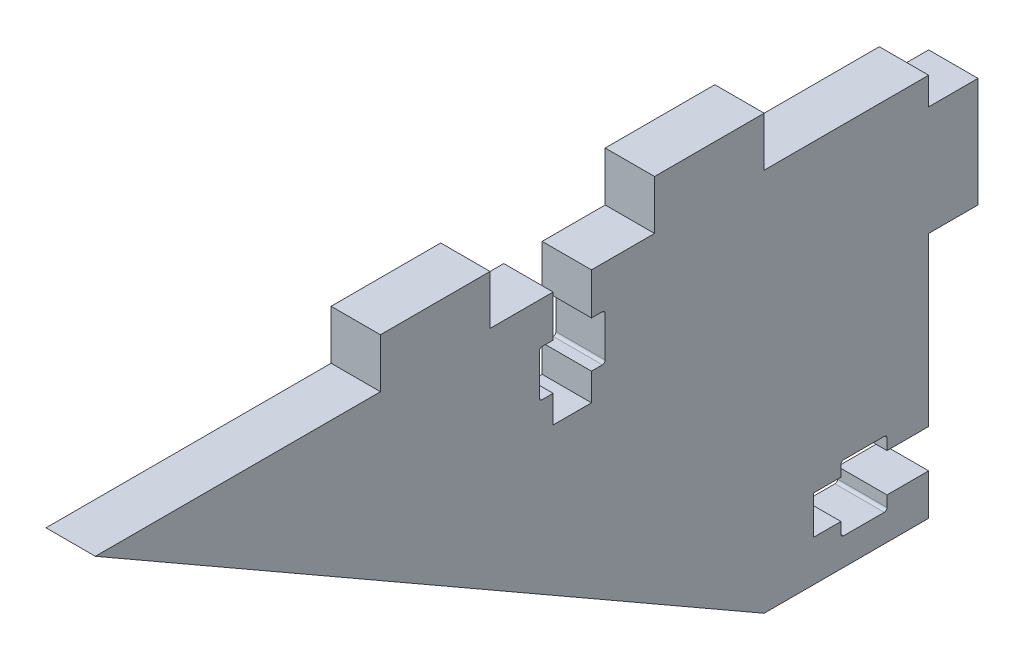
from build123d import *

# Parameters (mm, degrees)
BOSS_EXTRUDE1_DEPTH = 4.5
SKETCH2_W           = 9
SKETCH2_H           = 10
BOSS_EXTRUDE2_DEPTH = 4.5
BOSS_EXTRUDE3_DEPTH = 4.5
CUT_EXTRUDE1_DEPTH  = 84.792899461
SKETCH5_W           = 10
SKETCH5_H           = 9
BOSS_EXTRUDE4_DEPTH = 4.5
CUT_EXTRUDE2_DEPTH  = 84.792899461


with BuildPart() as part:
    # Sketch1 → Boss-Extrude1 (new body)
    with BuildSketch(Plane(origin=(0, 0, 0), x_dir=(0, 0, -1), z_dir=(1, 0, 0))):
        Polygon((0, 0), (0, -35), (-76, 0), align=None)
    extrude(amount=BOSS_EXTRUDE1_DEPTH)

    # Sketch2 → Boss-Extrude2 (add, through all)
    with BuildSketch(Plane(origin=(4.5, 0, 0), x_dir=(0, 0, -1), z_dir=(1, 0, 0))):
        with Locations((0, -7.5)):
            Rectangle(SKETCH2_W, SKETCH2_H)
    extrude(amount=-BOSS_EXTRUDE2_DEPTH)

    # Sketch3 → Boss-Extrude3 (add, through all)
    with BuildSketch(Plane(origin=(4.5, 0, 0), x_dir=(0, 0, -1), z_dir=(1, 0, 0))):
        Polygon((0, -35), (-15, -35), (-76, 0), (0, -25), align=None)
    extrude(amount=-BOSS_EXTRUDE3_DEPTH)

    # Sketch4 → Cut-Extrude1 (cut, through all)
    with BuildSketch(Plane(origin=(4.5, 0, 0), x_dir=(0, 0, -1), z_dir=(1, 0, 0))):
        with BuildLine():
            Line((0, -31.25), (0, -27.75))
            Line((0, -27.75), (-3.8, -27.75))
            Line((-3.8, -27.75), (-3.8, -26.75))
            ThreePointArc((-3.8, -26.75), (-3.873223305, -26.573223305), (-4.05, -26.5))
            Line((-4.05, -26.5), (-7.75, -26.5))
            ThreePointArc((-7.75, -26.5), (-7.926776695, -26.573223305), (-8, -26.75))
            Line((-8, -26.75), (-8, -27.75))
            Line((-8, -27.75), (-10.5, -27.75))
            Line((-10.5, -27.75), (-10.5, -31.25))
            Line((-10.5, -31.25), (-8, -31.25))
            Line((-8, -31.25), (-8, -32.25))
            ThreePointArc((-8, -32.25), (-7.926776695, -32.426776695), (-7.75, -32.5))
            Line((-7.75, -32.5), (-4.05, -32.5))
            ThreePointArc((-4.05, -32.5), (-3.873223305, -32.426776695), (-3.8, -32.25))
            Line((-3.8, -32.25), (-3.8, -31.25))
            Line((-3.8, -31.25), (0, -31.25))
        make_face()
    extrude(amount=-CUT_EXTRUDE1_DEPTH, mode=Mode.SUBTRACT)

    # Sketch5 → Boss-Extrude4 (add, through all)
    with BuildSketch(Plane(origin=(4.5, 0, 0), x_dir=(0, 0, -1), z_dir=(1, 0, 0))):
        with Locations((-20, 0)):
            Rectangle(SKETCH5_W, SKETCH5_H)
        with Locations((-45, 0)):
            Rectangle(SKETCH5_W, SKETCH5_H)
    extrude(amount=-BOSS_EXTRUDE4_DEPTH)

    # Sketch6 → Cut-Extrude2 (cut, through all)
    with BuildSketch(Plane(origin=(4.5, 0, 0), x_dir=(0, 0, -1), z_dir=(1, 0, 0))):
        with BuildLine():
            Line((-30.75, 0), (-34.25, 0))
            Line((-34.25, 0), (-34.25, -3.8))
            Line((-34.25, -3.8), (-35.25, -3.8))
            ThreePointArc((-35.25, -3.8), (-35.426776695, -3.873223305), (-35.5, -4.05))
            Line((-35.5, -4.05), (-35.5, -7.75))
            ThreePointArc((-35.5, -7.75), (-35.426776695, -7.926776695), (-35.25, -8))
            Line((-35.25, -8), (-34.25, -8))
            Line((-34.25, -8), (-34.25, -10.5))
            Line((-34.25, -10.5), (-30.75, -10.5))
            Line((-30.75, -10.5), (-30.75, -8))
            Line((-30.75, -8), (-29.75, -8))
            ThreePointArc((-29.75, -8), (-29.573223305, -7.926776695), (-29.5, -7.75))
            Line((-29.5, -7.75), (-29.5, -4.05))
            ThreePointArc((-29.5, -4.05), (-29.573223305, -3.873223305), (-29.75, -3.8))
            Line((-29.75, -3.8), (-30.75, -3.8))
            Line((-30.75, -3.8), (-30.75, 0))
        make_face()
    extrude(amount=-CUT_EXTRUDE2_DEPTH, mode=Mode.SUBTRACT)


solid = part.part
